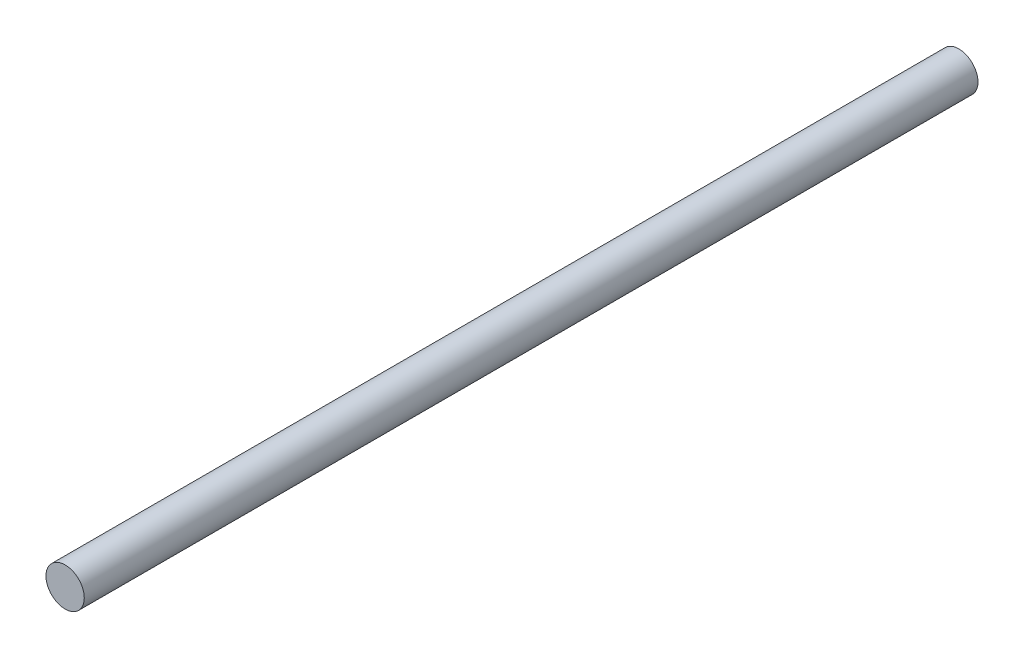
from build123d import *

# Parameters (mm, degrees)
SKETCH1_R           = 3.81
BOSS_EXTRUDE1_DEPTH = 177.8


with BuildPart() as part:
    # Sketch1 → Boss-Extrude1 (new body)
    with BuildSketch(Plane.XY):
        Circle(SKETCH1_R)
    extrude(amount=BOSS_EXTRUDE1_DEPTH)


solid = part.part
